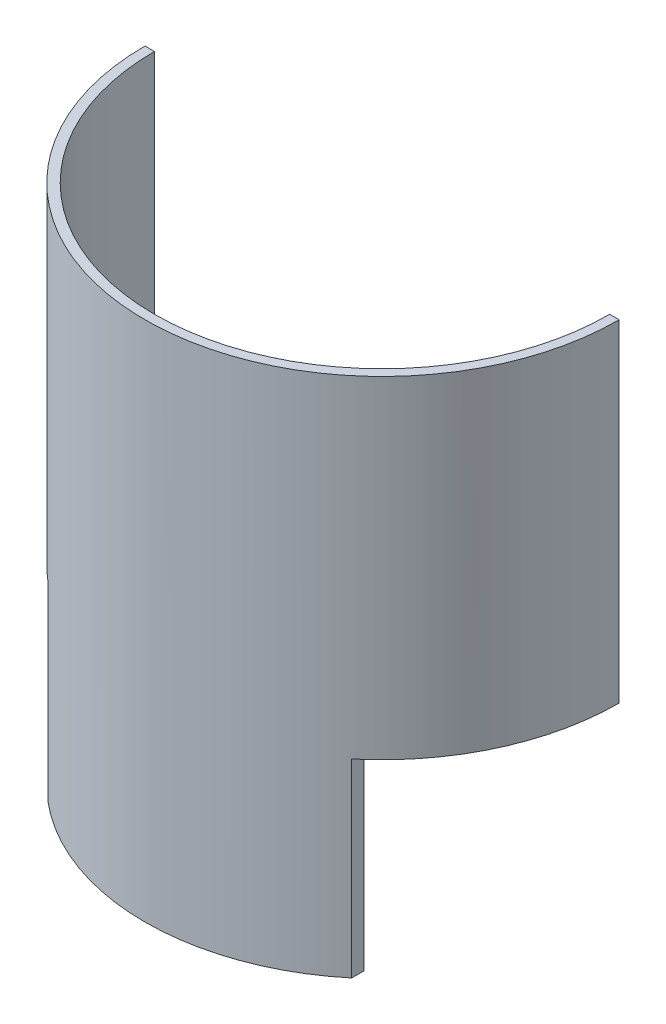
from build123d import *

# Parameters (mm, degrees)
BOSS_EXTRUDE1_DEPTH = 10
BOSS_EXTRUDE2_START = 10
BOSS_EXTRUDE2_DEPTH = 17.5


with BuildPart() as part:
    # Sketch1 → Boss-Extrude1 (new body)
    with BuildSketch(Plane(origin=(0, 0, 0), x_dir=(1, 0, 0), z_dir=(0, 1, 0))):
        with BuildLine():
            Line((-8, -8.94427191), (-8, -9.604686356))
            ThreePointArc((-8, -9.604686356), (0, -12.5), (8, -9.604686356))
            Line((8, -9.604686356), (8, -8.94427191))
            ThreePointArc((8, -8.94427191), (0, -12), (-8, -8.94427191))
        make_face()
    extrude(amount=BOSS_EXTRUDE1_DEPTH)

    # Sketch1<3> → Boss-Extrude2 (add)
    with BuildSketch(Plane(origin=(0, 0, 0), x_dir=(1, 0, 0), z_dir=(0, 1, 0)).offset(BOSS_EXTRUDE2_START)):
        with BuildLine():
            Line((-12, 0), (-12.5, 0))
            ThreePointArc((-12.5, 0), (-11.319231423, -5.303300859), (-8, -9.604686356))
            Line((-8, -9.604686356), (-8, -8.94427191))
            ThreePointArc((-8, -8.94427191), (-10.95445115, -4.898979486), (-12, 0))
        make_face()
        with BuildLine():
            Line((-8, -8.94427191), (-8, -9.604686356))
            ThreePointArc((-8, -9.604686356), (0, -12.5), (8, -9.604686356))
            Line((8, -9.604686356), (8, -8.94427191))
            ThreePointArc((8, -8.94427191), (0, -12), (-8, -8.94427191))
        make_face()
        with BuildLine():
            Line((8, -8.94427191), (8, -9.604686356))
            ThreePointArc((8, -9.604686356), (11.319231423, -5.303300859), (12.5, 0))
            Line((12.5, 0), (12, 0))
            ThreePointArc((12, 0), (10.95445115, -4.898979486), (8, -8.94427191))
        make_face()
    extrude(amount=BOSS_EXTRUDE2_DEPTH)


solid = part.part
